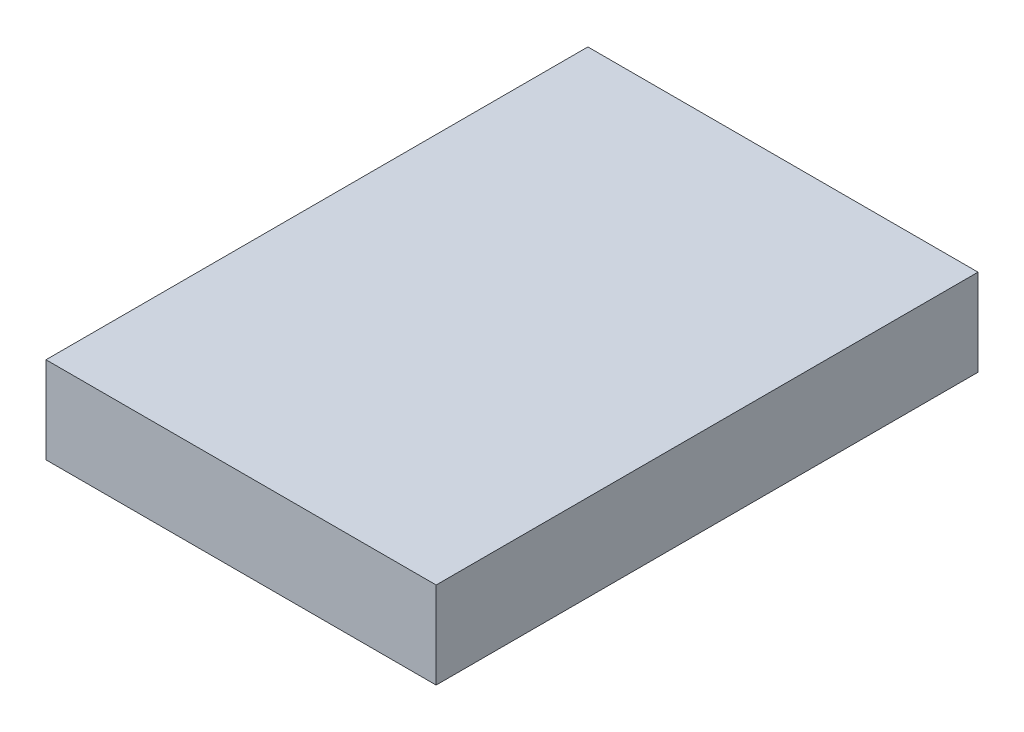
from build123d import *

# Parameters (mm, degrees)
SKETCH1_W           = 18
SKETCH1_H           = 25
BOSS_EXTRUDE1_DEPTH = 1
SKETCH2_W           = 18
SKETCH2_H           = 25
BOSS_EXTRUDE2_DEPTH = 3


with BuildPart() as part:
    # Sketch1 → Boss-Extrude1 (new body)
    with BuildSketch(Plane(origin=(0, 0, 0), x_dir=(1, 0, 0), z_dir=(0, 1, 0))):
        with Locations((0, 3.5)):
            Rectangle(SKETCH1_W, SKETCH1_H)
        with BuildLine():
            Line((-4, 13), (4, 13))
            Line((4, 13), (4, 5.5))
            Line((4, 5.5), (4, 4.898979486))
            ThreePointArc((4, 4.898979486), (4.0741799, 4.521015013), (4.285714286, 4.199125273))
            ThreePointArc((4.285714286, 4.199125273), (0, -6), (-4.285714286, 4.199125273))
            ThreePointArc((-4.285714286, 4.199125273), (-4.0741799, 4.521015013), (-4, 4.898979486))
            Line((-4, 4.898979486), (-4, 5.5))
            Line((-4, 5.5), (-4, 13))
        make_face(mode=Mode.SUBTRACT)
    extrude(amount=BOSS_EXTRUDE1_DEPTH)

    # Sketch2 → Boss-Extrude2 (add)
    with BuildSketch(Plane(origin=(0, 1, 0), x_dir=(1, 0, 0), z_dir=(0, 1, 0))):
        with Locations((0, 3.5)):
            Rectangle(SKETCH2_W, SKETCH2_H)
    extrude(amount=BOSS_EXTRUDE2_DEPTH)


solid = part.part
